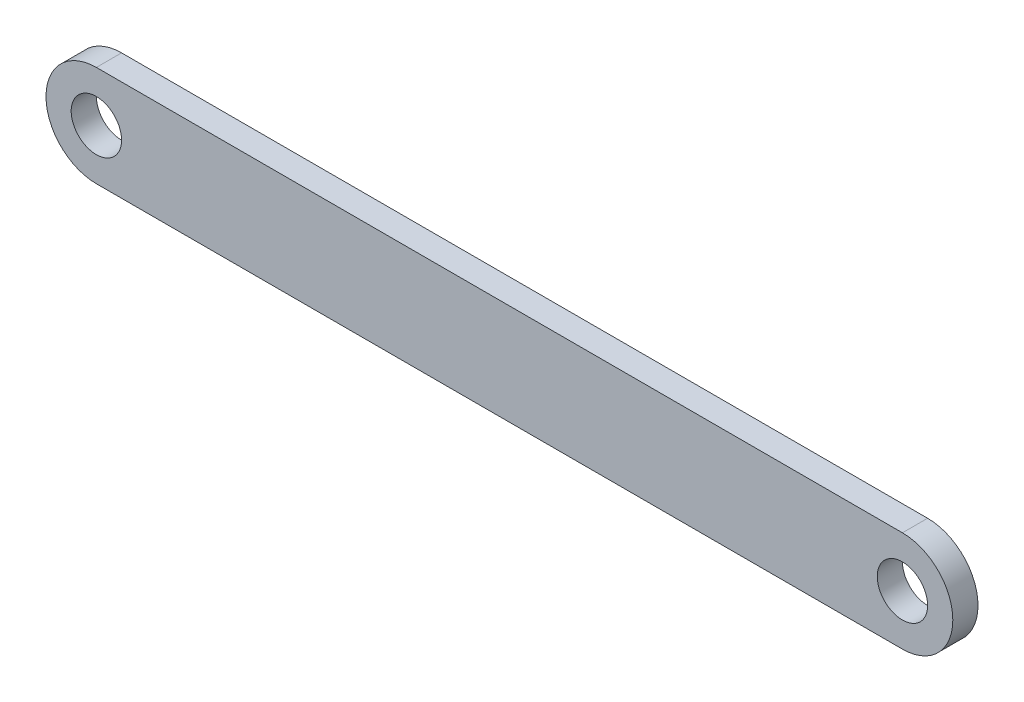
from build123d import *

# Parameters (mm, degrees)
BOSS_EXTRUDE1_DEPTH = 3.175
SKETCH3_R           = 3.175
CUT_EXTRUDE1_DEPTH  = 58.589283942


with BuildPart() as part:
    # Sketch2 → Boss-Extrude1 (new body)
    with BuildSketch(Plane.XY):
        with BuildLine():
            Line((-50.8, 6.35), (50.8, 6.35))
            ThreePointArc((50.8, 6.35), (57.15, 0), (50.8, -6.35))
            Line((50.8, -6.35), (-50.8, -6.35))
            ThreePointArc((-50.8, -6.35), (-57.15, 0), (-50.8, 6.35))
        make_face()
    extrude(amount=BOSS_EXTRUDE1_DEPTH)

    # Sketch3 → Cut-Extrude1 (cut, through all)
    with BuildSketch(Plane.XY.offset(3.175)):
        with Locations((-50.8, 0)):
            Circle(SKETCH3_R)
        with Locations(Location((50.8, 0, 0), (0, 0, 180))):
            Circle(SKETCH3_R)
    extrude(amount=-CUT_EXTRUDE1_DEPTH, mode=Mode.SUBTRACT)


solid = part.part
